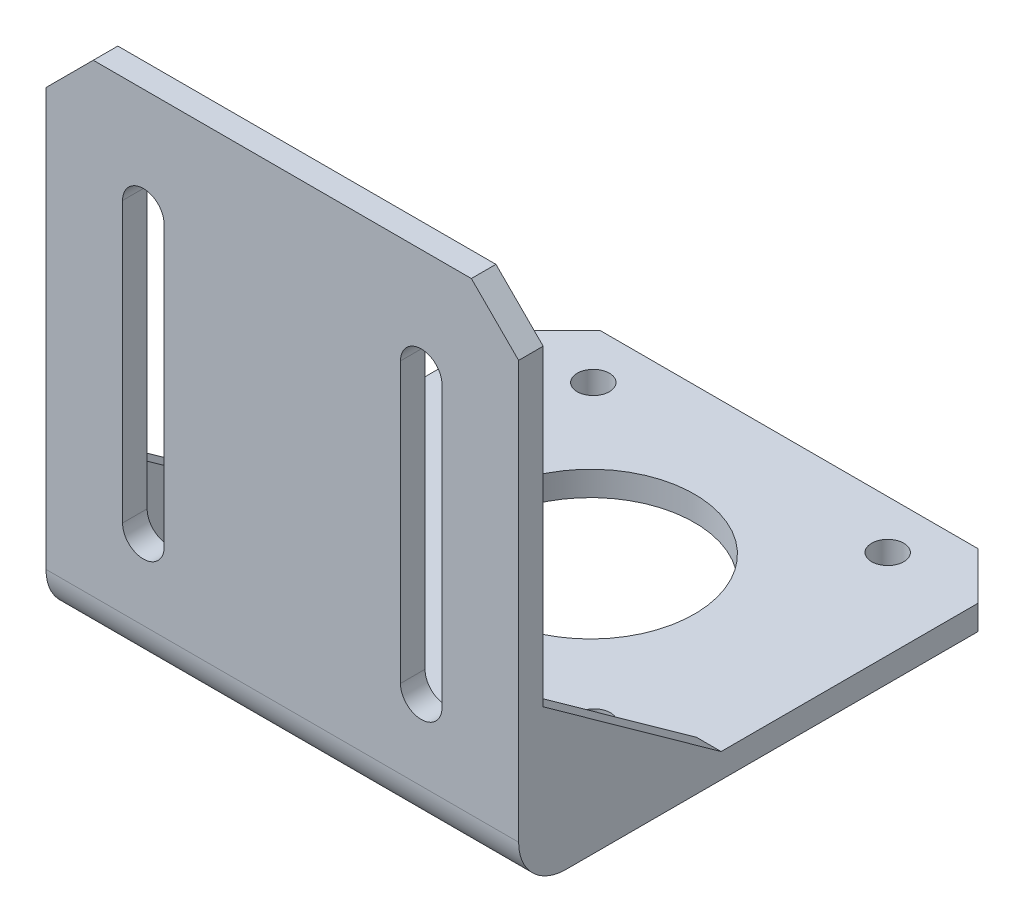
from build123d import *

# Parameters (mm, degrees)
SALIENTE_EXTRUIR1_DEPTH = 2.6
CROQUIS5_W              = 50
CROQUIS5_H              = 2.6
SALIENTE_EXTRUIR2_DEPTH = 51
REDONDEO1_R             = 5
CROQUIS7_R              = 11
CROQUIS7_R_2            = 1.7
CORTAR_EXTRUIR1_DEPTH   = 77.703340866
CHAFL_N1_SIZE           = 5
CROQUIS8_W              = 2.6
CROQUIS8_H              = 20
SALIENTE_EXTRUIR3_DEPTH = 14.5
CORTAR_EXTRUIR2_DEPTH   = 77.380989945
REDONDEO2_R             = 2.6


with BuildPart() as part:
    # Croquis3 → Saliente-Extruir1 (new body)
    with BuildSketch(Plane.XY):
        Polygon((-25, -27.075), (25, -27.075), (25, 22.075), (20, 27.075), (-20, 27.075), (-25, 22.075), align=None)
        with BuildLine():
            Line((16.9, 15.775), (16.9, -13.775))
            ThreePointArc((16.9, -13.775), (14.7, -15.975), (12.5, -13.775))
            Line((12.5, -13.775), (12.5, 15.775))
            ThreePointArc((12.5, 15.775), (14.7, 17.975), (16.9, 15.775))
        make_face(mode=Mode.SUBTRACT)
        with BuildLine():
            Line((-16.9, 15.775), (-16.9, -13.775))
            ThreePointArc((-16.9, -13.775), (-14.7, -15.975), (-12.5, -13.775))
            Line((-12.5, -13.775), (-12.5, 15.775))
            ThreePointArc((-12.5, 15.775), (-14.7, 17.975), (-16.9, 15.775))
        make_face(mode=Mode.SUBTRACT)
    extrude(amount=SALIENTE_EXTRUIR1_DEPTH)

    # Croquis5 → Saliente-Extruir2 (add)
    with BuildSketch(Plane(origin=(0, 0, 0), x_dir=(-1, 0, 0), z_dir=(0, 0, -1))):
        with Locations((0, -25.775)):
            Rectangle(CROQUIS5_W, CROQUIS5_H)
    extrude(amount=SALIENTE_EXTRUIR2_DEPTH)

    # Redondeo1
    redondeo1_edges = [part.edges().sort_by_distance(p)[0] for p in [
        (0, -27.075, 2.6),
    ]]
    fillet(redondeo1_edges, radius=REDONDEO1_R)

    # Croquis7 → Cortar-Extruir1 (cut, through all)
    with BuildSketch(Plane(origin=(0, -24.475, 0), x_dir=(1, 0, 0), z_dir=(0, 1, 0))):
        with Locations(Location((0, 30, 0), (0, 0, 270))):
            Circle(CROQUIS7_R)
        with Locations(Location((-15.575, 45.875, 0), (0, 0, 270))):
            Circle(CROQUIS7_R_2)
        with Locations(Location((15.575, 45.875, 0), (0, 0, 270))):
            Circle(CROQUIS7_R_2)
        with Locations(Location((15.575, 14.825, 0), (0, 0, 270))):
            Circle(CROQUIS7_R_2)
        with Locations(Location((-15.575, 14.725, 0), (0, 0, 270))):
            Circle(CROQUIS7_R_2)
    extrude(amount=-CORTAR_EXTRUIR1_DEPTH, mode=Mode.SUBTRACT)

    # Chaflán1
    chafl_n1_edges = [part.edges().sort_by_distance(p)[0] for p in [
        (25, -25.775, -51),
        (-25, -25.775, -51),
    ]]
    chamfer(chafl_n1_edges, length=CHAFL_N1_SIZE)

    # Croquis8 → Saliente-Extruir3 (add)
    with BuildSketch(Plane(origin=(0, -24.475, 0), x_dir=(1, 0, 0), z_dir=(0, 1, 0))):
        with Locations((-23.7, 10)):
            Rectangle(CROQUIS8_W, CROQUIS8_H)
        with Locations((23.7, 10)):
            Rectangle(CROQUIS8_W, CROQUIS8_H)
    extrude(amount=SALIENTE_EXTRUIR3_DEPTH)

    # Croquis9 → Cortar-Extruir2 (cut, through all)
    with BuildSketch(Plane.ZY.offset(25)):
        Polygon((-20, -24.475), (-18.827189976, -24.475), (0, -10.965826599), (0, -9.975), (-20, -9.975), align=None)
    extrude(amount=-CORTAR_EXTRUIR2_DEPTH, mode=Mode.SUBTRACT)

    # Redondeo2
    redondeo2_edges = [part.edges().sort_by_distance(p)[0] for p in [
        (0, -24.475, 0),
    ]]
    fillet(redondeo2_edges, radius=REDONDEO2_R)


solid = part.part
